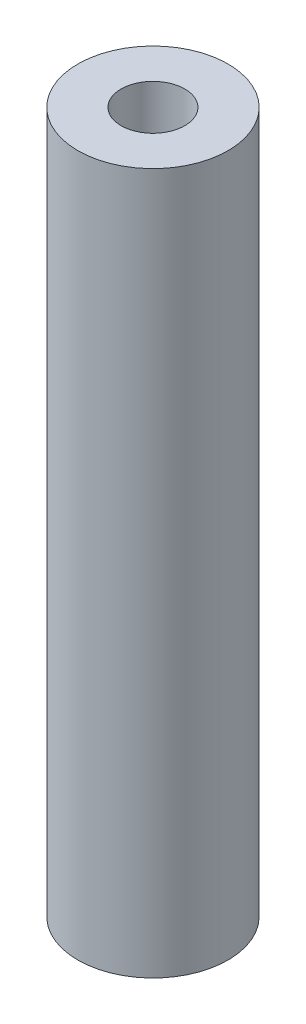
from build123d import *

# Parameters (mm, degrees)
SKETCH1_R           = 4.7625
SKETCH1_R_2         = 2.0193
BOSS_EXTRUDE1_DEPTH = 44.45


with BuildPart() as part:
    # Sketch1 → Boss-Extrude1 (new body)
    with BuildSketch(Plane(origin=(0, 0, 0), x_dir=(1, 0, 0), z_dir=(0, 1, 0))):
        with Locations(Location((0, 0, 0), (0, 0, 270))):
            Circle(SKETCH1_R)
        with Locations(Location((0, 0, 0), (0, 0, 270))):
            Circle(SKETCH1_R_2, mode=Mode.SUBTRACT)
    extrude(amount=BOSS_EXTRUDE1_DEPTH)


solid = part.part
